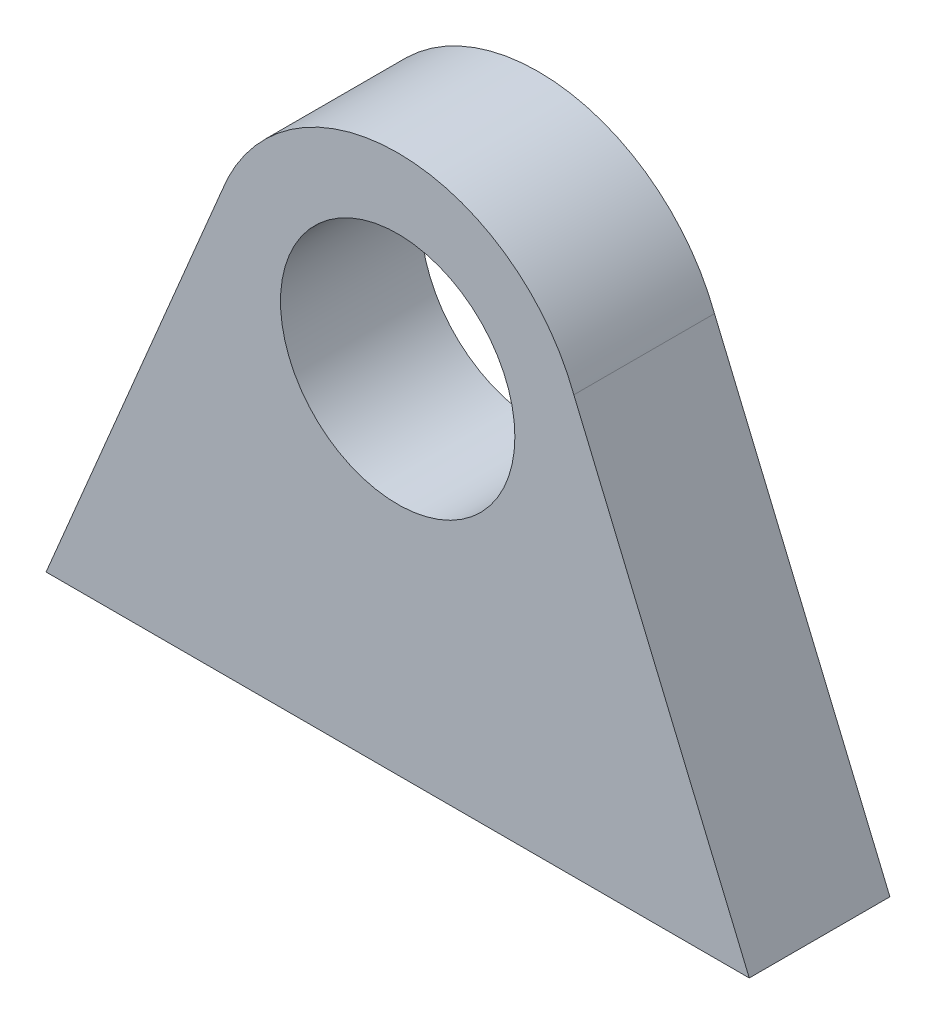
from build123d import *

# Parameters (mm, degrees)
SKETCH1_R      = 25
EXTRUDE1_DEPTH = 30


with BuildPart() as part:
    # Sketch1 → Extrude1 (new body)
    with BuildSketch(Plane.XY):
        with BuildLine():
            Line((0, 0), (37.440331543, 89.067029145))
            ThreePointArc((37.440331543, 89.067029145), (75.023134104, 114.954741353), (112.577190444, 89.025345985))
            Line((112.577190444, 89.025345985), (150, 0))
            Line((150, 0), (0, 0))
        make_face()
        with Locations((75, 75)):
            Circle(SKETCH1_R, mode=Mode.SUBTRACT)
    extrude(amount=EXTRUDE1_DEPTH)


solid = part.part
